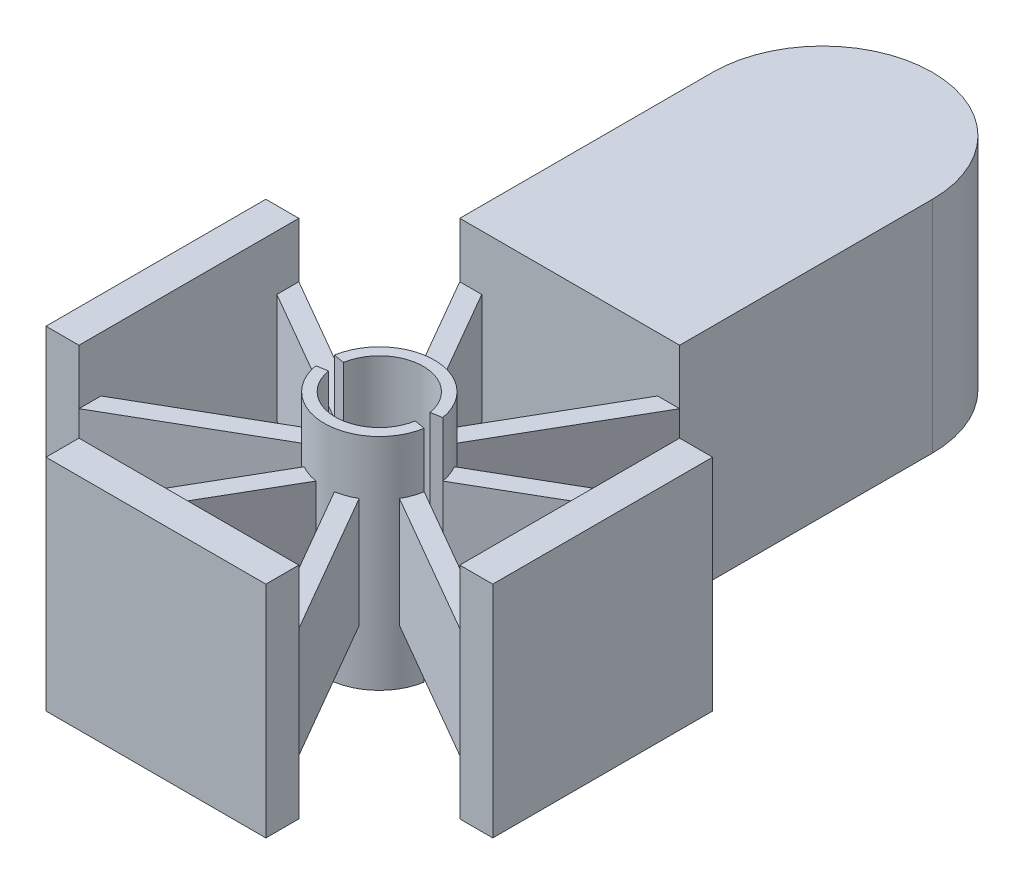
from build123d import *

# Parameters (mm, degrees)
SKETCH1_W                     = 10
SKETCH1_H                     = 1.5
BASE_BUTTERFLY_BLOCKS_DEPTH   = 5
SKETCH1_W_2                   = 1.5
SKETCH1_H_2                   = 10
BASE_BUTTERFLY_BLOCKS_2_DEPTH = 5
BASE_BUTTERFLY_BLOCKS_3_DEPTH = 5
BASE_BUTTERFLY_BLOCKS_4_DEPTH = 5
BASE_BUTTERFLY_BLOCKS_5_DEPTH = 5
BASE_BUTTERFLY_BLOCKS_6_DEPTH = 5
BASE_BUTTERFLY_FLEXURES_DEPTH = 2.5
SKETCH3_W                     = 10
SKETCH3_H                     = 10
BOSS_EXTRUDE4_DEPTH           = 10
BOSS_EXTRUDE5_DEPTH           = 10


with BuildPart() as part:
    # Sketch1 → base_butterfly_blocks (new, symmetric)
    with BuildSketch(Plane(origin=(0, 0, 0), x_dir=(1, 0, 0), z_dir=(0, 1, 0))):
        with Locations((0, -9.410254038)):
            Rectangle(SKETCH1_W, SKETCH1_H)
    extrude(amount=BASE_BUTTERFLY_BLOCKS_DEPTH, both=True)



with BuildPart() as body_2:
    # Sketch1 → base_butterfly_blocks 2 (new, symmetric)
    with BuildSketch(Plane(origin=(0, 0, 0), x_dir=(1, 0, 0), z_dir=(0, 1, 0))):
        with Locations((-9.410254038, 0)):
            Rectangle(SKETCH1_W_2, SKETCH1_H_2)
    extrude(amount=BASE_BUTTERFLY_BLOCKS_2_DEPTH, both=True)


with BuildPart() as body_3:
    # Sketch1 → base_butterfly_blocks 3 (new, symmetric)
    with BuildSketch(Plane(origin=(0, 0, 0), x_dir=(1, 0, 0), z_dir=(0, 1, 0))):
        with Locations((0, 9.410254038)):
            Rectangle(SKETCH1_W, SKETCH1_H)
    extrude(amount=BASE_BUTTERFLY_BLOCKS_3_DEPTH, both=True)


with BuildPart() as body_4:
    # Sketch1 → base_butterfly_blocks 4 (new, symmetric)
    with BuildSketch(Plane(origin=(0, 0, 0), x_dir=(1, 0, 0), z_dir=(0, 1, 0))):
        with Locations((9.410254038, 0)):
            Rectangle(SKETCH1_W_2, SKETCH1_H_2)
    extrude(amount=BASE_BUTTERFLY_BLOCKS_4_DEPTH, both=True)


with BuildPart() as body_5:
    # Sketch1 → base_butterfly_blocks 5 (new, symmetric)
    with BuildSketch(Plane(origin=(0, 0, 0), x_dir=(1, 0, 0), z_dir=(0, 1, 0))):
        with BuildLine():
            Line((-1.971217842, 0.338083152), (-2.464022303, 0.42260394))
            ThreePointArc((-2.464022303, 0.42260394), (0, 2.5), (2.464022303, 0.42260394))
            Line((2.464022303, 0.42260394), (1.971217842, 0.338083152))
            ThreePointArc((1.971217842, 0.338083152), (0, 2), (-1.971217842, 0.338083152))
        make_face()
    extrude(amount=BASE_BUTTERFLY_BLOCKS_5_DEPTH, both=True)


with BuildPart() as body_6:
    # Sketch1 → base_butterfly_blocks 6 (new, symmetric)
    with BuildSketch(Plane(origin=(0, 0, 0), x_dir=(1, 0, 0), z_dir=(0, 1, 0))):
        with BuildLine():
            ThreePointArc((-1.971217842, -0.338083152), (0, -2), (1.971217842, -0.338083152))
            Line((1.971217842, -0.338083152), (2.464022303, -0.42260394))
            ThreePointArc((2.464022303, -0.42260394), (0, -2.5), (-2.464022303, -0.42260394))
            Line((-2.464022303, -0.42260394), (-1.971217842, -0.338083152))
        make_face()
    extrude(amount=BASE_BUTTERFLY_BLOCKS_6_DEPTH, both=True)


with BuildPart() as part_1:
    add(part.part)

    add(body_2.part)  # base_butterfly_flexures merges body 2

    add(body_3.part)  # base_butterfly_flexures merges body 3

    add(body_4.part)  # base_butterfly_flexures merges body 4

    add(body_5.part)  # base_butterfly_flexures merges body 5

    add(body_6.part)  # base_butterfly_flexures merges body 6
    # Sketch1<4> → base_butterfly_flexures (add, symmetric)
    with BuildSketch(Plane(origin=(0, 0, 0), x_dir=(1, 0, 0), z_dir=(0, 1, 0))):
        with BuildLine():
            Line((-8.660254038, 5), (-8.660254038, 4))
            Line((-8.660254038, 4), (-2.464022303, 0.42260394))
            ThreePointArc((-2.464022303, 0.42260394), (-2.351224133, 0.84955581), (-2.165063509, 1.25))
            Line((-2.165063509, 1.25), (-8.660254038, 5))
        make_face()
        with BuildLine():
            Line((-5, 8.660254038), (-1.25, 2.165063509))
            ThreePointArc((-1.25, 2.165063509), (-0.84955581, 2.351224133), (-0.42260394, 2.464022303))
            Line((-0.42260394, 2.464022303), (-4, 8.660254038))
            Line((-4, 8.660254038), (-5, 8.660254038))
        make_face()
        with BuildLine():
            Line((4, 8.660254038), (0.42260394, 2.464022303))
            ThreePointArc((0.42260394, 2.464022303), (0.84955581, 2.351224133), (1.25, 2.165063509))
            Line((1.25, 2.165063509), (5, 8.660254038))
            Line((5, 8.660254038), (4, 8.660254038))
        make_face()
        with BuildLine():
            Line((2.464022303, 0.42260394), (8.660254038, 4))
            Line((8.660254038, 4), (8.660254038, 5))
            Line((8.660254038, 5), (2.165063509, 1.25))
            ThreePointArc((2.165063509, 1.25), (2.351224133, 0.84955581), (2.464022303, 0.42260394))
        make_face()
        with BuildLine():
            ThreePointArc((2.464022303, -0.42260394), (2.351224133, -0.84955581), (2.165063509, -1.25))
            Line((2.165063509, -1.25), (8.660254038, -5))
            Line((8.660254038, -5), (8.660254038, -4))
            Line((8.660254038, -4), (2.464022303, -0.42260394))
        make_face()
        with BuildLine():
            ThreePointArc((1.25, -2.165063509), (0.84955581, -2.351224133), (0.42260394, -2.464022303))
            Line((0.42260394, -2.464022303), (4, -8.660254038))
            Line((4, -8.660254038), (5, -8.660254038))
            Line((5, -8.660254038), (1.25, -2.165063509))
        make_face()
        with BuildLine():
            ThreePointArc((-0.42260394, -2.464022303), (-0.84955581, -2.351224133), (-1.25, -2.165063509))
            Line((-1.25, -2.165063509), (-5, -8.660254038))
            Line((-5, -8.660254038), (-4, -8.660254038))
            Line((-4, -8.660254038), (-0.42260394, -2.464022303))
        make_face()
        with BuildLine():
            Line((-8.660254038, -5), (-2.165063509, -1.25))
            ThreePointArc((-2.165063509, -1.25), (-2.351224133, -0.84955581), (-2.464022303, -0.42260394))
            Line((-2.464022303, -0.42260394), (-8.660254038, -4))
            Line((-8.660254038, -4), (-8.660254038, -5))
        make_face()
    extrude(amount=BASE_BUTTERFLY_FLEXURES_DEPTH, both=True)

    # Sketch3 → Boss-Extrude4 (add)
    with BuildSketch(Plane(origin=(0, 0, -10.160254038), x_dir=(-1, 0, 0), z_dir=(0, 0, -1))):
        Rectangle(SKETCH3_W, SKETCH3_H)
    extrude(amount=BOSS_EXTRUDE4_DEPTH)

    # Sketch4 → Boss-Extrude5 (add)
    with BuildSketch(Plane(origin=(0, 5, 0), x_dir=(1, 0, 0), z_dir=(0, 1, 0))):
        with BuildLine():
            ThreePointArc((-5, 20.160254038), (0, 25.160254038), (5, 20.160254038))
            Line((5, 20.160254038), (-5, 20.160254038))
        make_face()
    extrude(amount=-BOSS_EXTRUDE5_DEPTH)


solid = part_1.part
